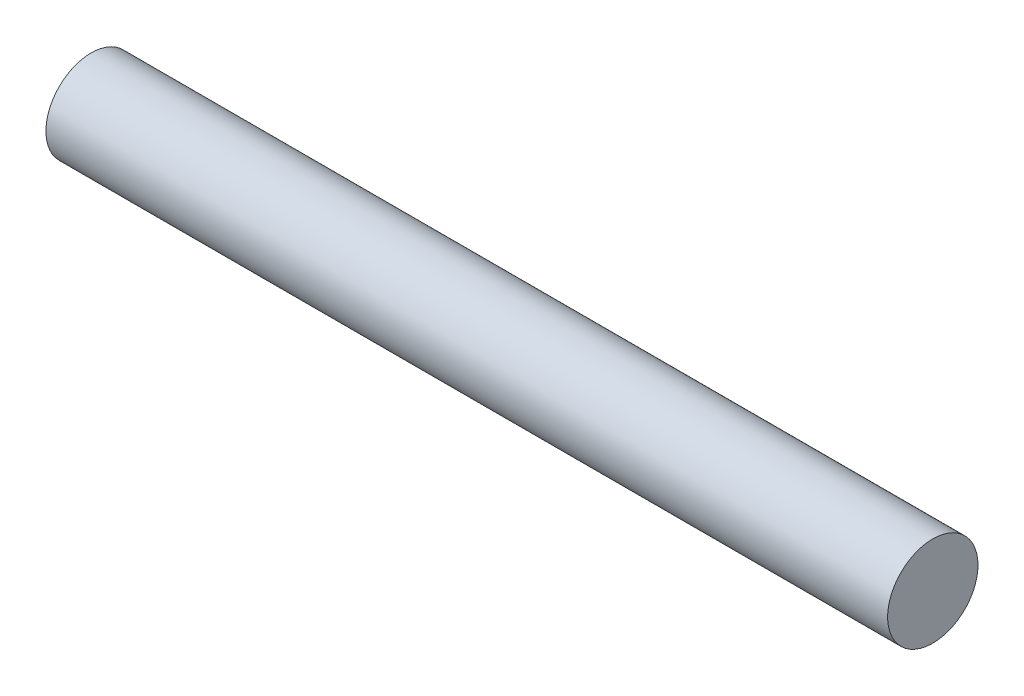
from build123d import *

# Parameters (mm, degrees)
SKETCH_1_R      = 40
EXTRUDE_1_DEPTH = 745


with BuildPart() as part:
    # Эскиз1 → Бобышка-Вытянуть1 (new body)
    with BuildSketch(Plane(origin=(0, 0, 0), x_dir=(0, 0, -1), z_dir=(1, 0, 0))):
        Circle(SKETCH_1_R)
    extrude(amount=EXTRUDE_1_DEPTH)


solid = part.part
